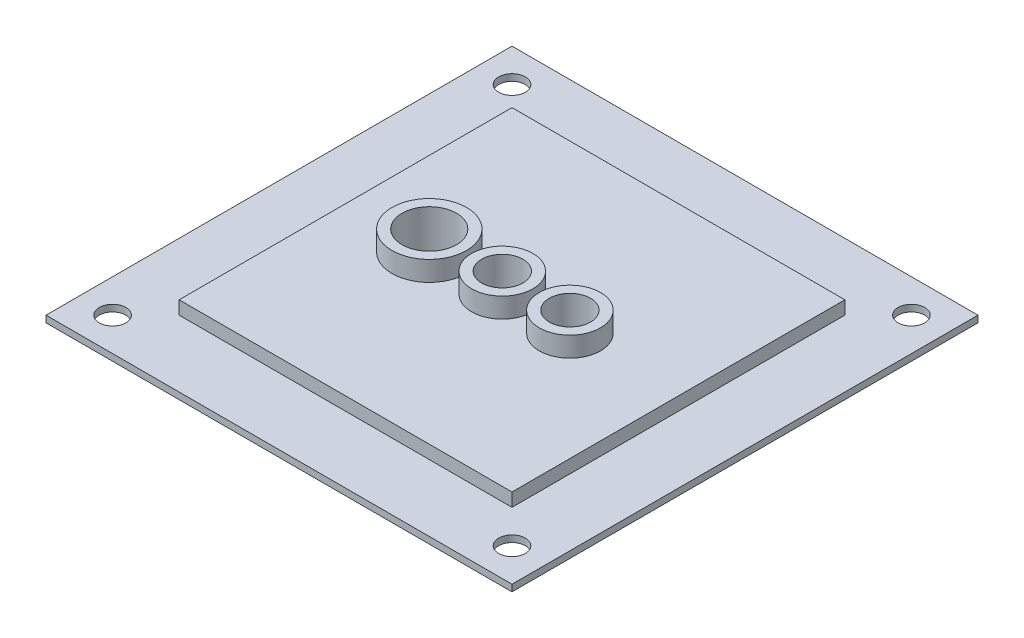
from build123d import *

# Parameters (mm, degrees)
SKETCH1_W           = 50
SKETCH1_H           = 50
SKETCH1_R           = 4.1
SKETCH1_R_2         = 3.1
BOSS_EXTRUDE1_DEPTH = 1.5
SKETCH2_R           = 5.6
SKETCH2_R_2         = 4.1
SKETCH2_R_3         = 4.6
SKETCH2_R_4         = 3.1
EXTRUDE_THIN1_DEPTH = 3
SKETCH3_W           = 70
SKETCH3_H           = 70
SKETCH3_R           = 2
SKETCH3_W_2         = 50
SKETCH3_H_2         = 50
BOSS_EXTRUDE2_DEPTH = 1


with BuildPart() as part:
    # Sketch1 → Boss-Extrude1 (new, symmetric)
    with BuildSketch(Plane(origin=(0, 0, 0), x_dir=(1, 0, 0), z_dir=(0, 1, 0))):
        with Locations((0, 25)):
            Rectangle(SKETCH1_W, SKETCH1_H)
        with Locations(Location((-12.426592672, 25, 0), (0, 0, 270))):
            Circle(SKETCH1_R, mode=Mode.SUBTRACT)
        with Locations(Location((-1.460779325, 25, 0), (0, 0, 270))):
            Circle(SKETCH1_R_2, mode=Mode.SUBTRACT)
        with Locations(Location((8.698724218, 25, 0), (0, 0, 270))):
            Circle(SKETCH1_R_2, mode=Mode.SUBTRACT)
    extrude(amount=BOSS_EXTRUDE1_DEPTH, both=True)

    # Sketch2 → Extrude-Thin1 (add)
    # profile 1 of 3: a face of its own
    with BuildSketch(Plane(origin=(0, 1.5, 0), x_dir=(1, 0, 0), z_dir=(0, 1, 0))):
        with Locations((-12.426592672, 25)):
            Circle(SKETCH2_R)
        with Locations((-12.426592672, 25)):
            Circle(SKETCH2_R_2, mode=Mode.SUBTRACT)
    # profile 2 of 3: a face of its own
    with BuildSketch(Plane(origin=(0, 1.5, 0), x_dir=(1, 0, 0), z_dir=(0, 1, 0))):
        with Locations((8.698724218, 25)):
            Circle(SKETCH2_R_3)
        with Locations((8.698724218, 25)):
            Circle(SKETCH2_R_4, mode=Mode.SUBTRACT)
    # profile 3 of 3: a face of its own
    with BuildSketch(Plane(origin=(0, 1.5, 0), x_dir=(1, 0, 0), z_dir=(0, 1, 0))):
        with Locations((-1.460779325, 25)):
            Circle(SKETCH2_R_3)
        with Locations((-1.460779325, 25)):
            Circle(SKETCH2_R_4, mode=Mode.SUBTRACT)
    extrude(amount=EXTRUDE_THIN1_DEPTH)

    # Sketch3 → Boss-Extrude2 (add)
    with BuildSketch(Plane.XZ.offset(1.5)):
        with Locations((0, -25)):
            Rectangle(SKETCH3_W, SKETCH3_H)
        with Locations(Location((-30, 5, 0), (0, 0, 270))):
            Circle(SKETCH3_R, mode=Mode.SUBTRACT)
        with Locations(Location((30, 5, 0), (0, 0, 270))):
            Circle(SKETCH3_R, mode=Mode.SUBTRACT)
        with Locations(Location((30, -55, 0), (0, 0, 270))):
            Circle(SKETCH3_R, mode=Mode.SUBTRACT)
        with Locations(Location((-30, -55, 0), (0, 0, 270))):
            Circle(SKETCH3_R, mode=Mode.SUBTRACT)
        with Locations((0, -25)):
            Rectangle(SKETCH3_W_2, SKETCH3_H_2, mode=Mode.SUBTRACT)
    extrude(amount=-BOSS_EXTRUDE2_DEPTH)


solid = part.part
